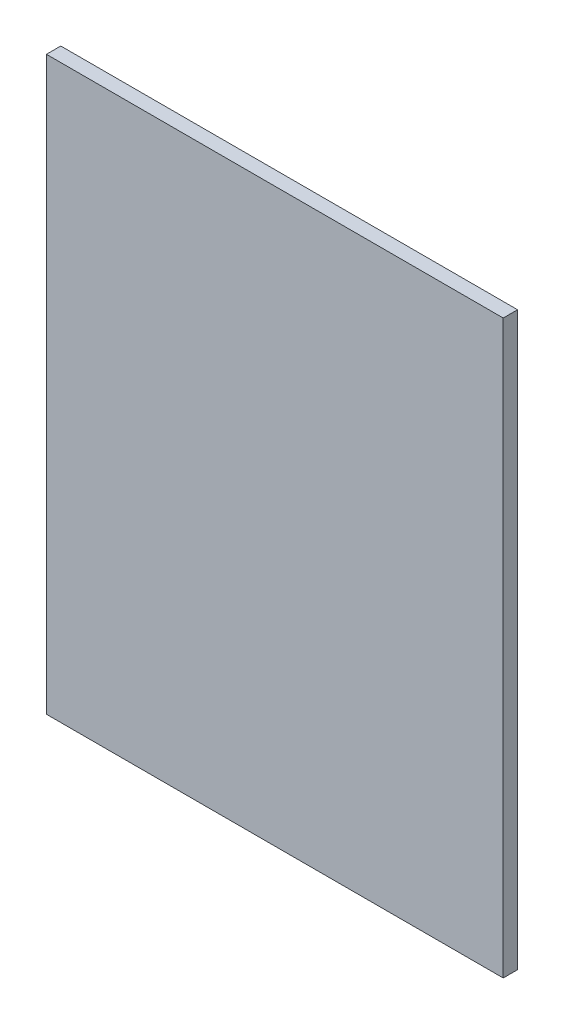
from build123d import *

# Parameters (mm, degrees)
SKETCH_1_W      = 3980
SKETCH_1_H      = 4980
EXTRUDE_1_DEPTH = 125


with BuildPart() as part:
    # 草图1 → 凸台-拉伸1 (new body)
    with BuildSketch(Plane.XY):
        Rectangle(SKETCH_1_W, SKETCH_1_H)
    extrude(amount=EXTRUDE_1_DEPTH)


solid = part.part
